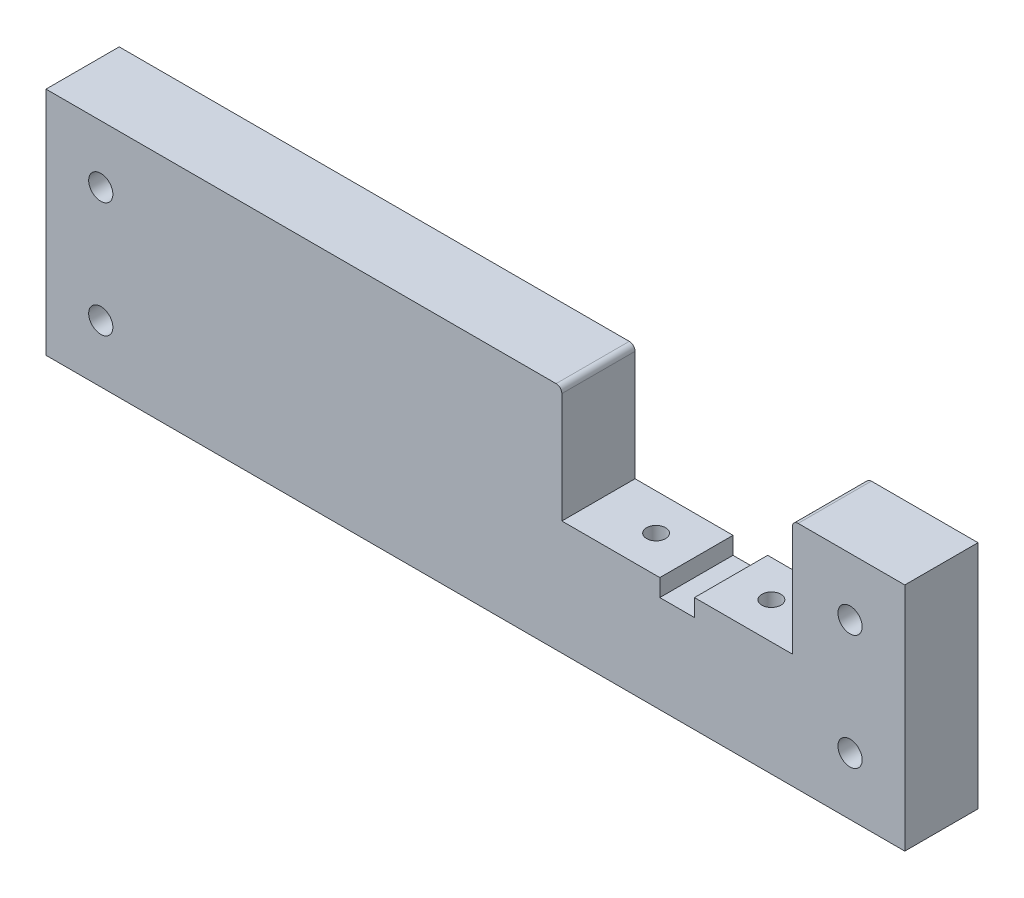
from build123d import *

# Parameters (mm, degrees)
BOSS_EXTRUDE1_DEPTH             = 12.7
TAP_DRILL_FOR_M4X0_7_TAP1_D     = 3.3
TAP_DRILL_FOR_M4X0_7_TAP1_DEPTH = 5
TAP_DRILL_FOR_M4X0_7_TAP1_TIP   = 0.991420021
TAP_DRILL_FOR_M5X0_8_TAP3_D     = 4.2
TAP_DRILL_FOR_M5X0_8_TAP2_D     = 4.2
TAP_DRILL_FOR_M5X0_8_TAP2_DEPTH = 7
TAP_DRILL_FOR_M5X0_8_TAP2_TIP   = 1.2618073
FILLET1_R                       = 1


with BuildPart() as part:
    # Sketch1 → Boss-Extrude1 (new body)
    with BuildSketch(Plane.XY):
        Polygon((15, 40), (-74.5, 40), (-74.5, 0), (74.5, 0), (74.5, 40), (55, 40), (55, 19.855), (38.005, 19.855), (38.005, 16.85), (31.995, 16.85), (31.995, 19.855), (15, 19.855), align=None)
    extrude(amount=-BOSS_EXTRUDE1_DEPTH)

    # Tap Drill for M4x0.7 Tap1
    with Locations(Plane(origin=(25, 19.855, -6.35), x_dir=(1, 0, 0), z_dir=(0, 1, 0))):
        with Locations((0, 0), (20, 0)):
            Hole(TAP_DRILL_FOR_M4X0_7_TAP1_D / 2, depth=TAP_DRILL_FOR_M4X0_7_TAP1_DEPTH)
            with Locations((0, 0, -(TAP_DRILL_FOR_M4X0_7_TAP1_DEPTH + TAP_DRILL_FOR_M4X0_7_TAP1_TIP / 2))):  # 118° drill point
                Cone(0, TAP_DRILL_FOR_M4X0_7_TAP1_D / 2, TAP_DRILL_FOR_M4X0_7_TAP1_TIP, mode=Mode.SUBTRACT)

    # Tap Drill for M5x0.8 Tap3 (through all)
    with Locations(Plane(origin=(-65, 30, 0), x_dir=(1, 0, 0), z_dir=(0, 0, 1))):
        with Locations((0, 0), (0, -20), (130, -20), (130, 0)):
            Hole(TAP_DRILL_FOR_M5X0_8_TAP3_D / 2)

    # Tap Drill for M5x0.8 Tap2
    with Locations(Plane(origin=(-60, 0, -6.35), x_dir=(-1, 0, 0), z_dir=(0, -1, 0))):
        with Locations((0, 0), (-60, 0), (-120, 0)):
            Hole(TAP_DRILL_FOR_M5X0_8_TAP2_D / 2, depth=TAP_DRILL_FOR_M5X0_8_TAP2_DEPTH)
            with Locations((0, 0, -(TAP_DRILL_FOR_M5X0_8_TAP2_DEPTH + TAP_DRILL_FOR_M5X0_8_TAP2_TIP / 2))):  # 118° drill point
                Cone(0, TAP_DRILL_FOR_M5X0_8_TAP2_D / 2, TAP_DRILL_FOR_M5X0_8_TAP2_TIP, mode=Mode.SUBTRACT)

    # Fillet1
    fillet1_edges = [part.edges().sort_by_distance(p)[0] for p in [
        (55, 40, -6.35),
        (15, 40, -6.35),
    ]]
    fillet(fillet1_edges, radius=FILLET1_R)


solid = part.part
